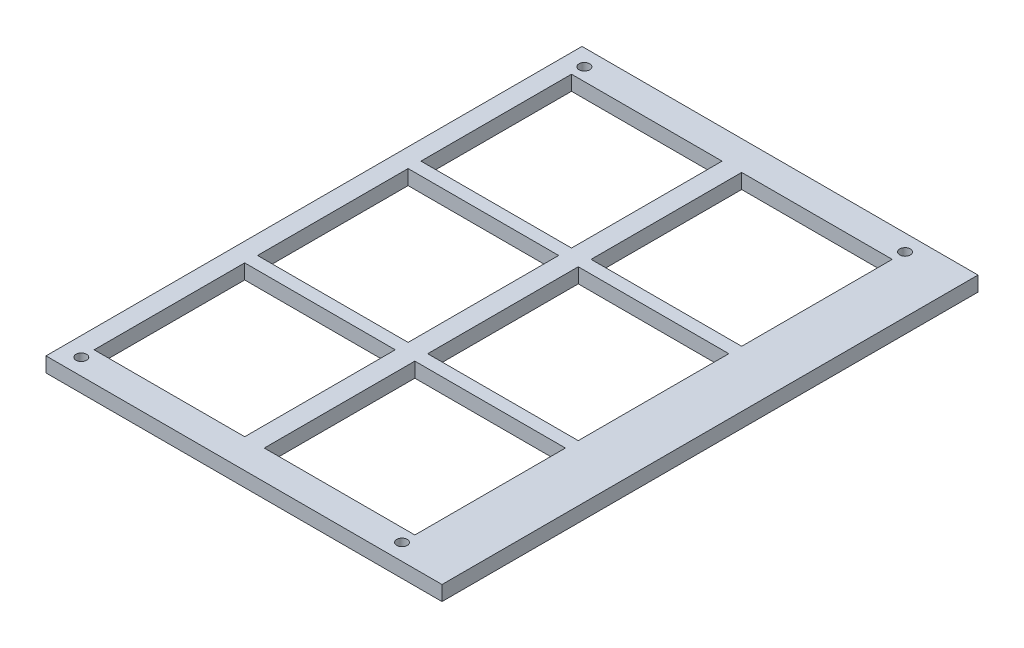
from build123d import *

# Parameters (mm, degrees)
SKETCH1_W                 = 267.22
SKETCH1_H                 = 361.68
SKETCH1_R                 = 3.57
BOSS_EXTRUDE1_DEPTH       = 10
SKETCH2_W                 = 101.6
SKETCH2_H                 = 101.6
CUT_EXTRUDE1_DEPTH        = 226.066074076
LPATTERN1_COUNT           = 2
LPATTERN1_PITCH           = 110.265
LPATTERN2_COUNT           = 2
LPATTERN2_PITCH           = 110.265
LPATTERN3_COUNT           = 2
LPATTERN3_PITCH           = 114.82
LPATTERN3_COPY_1_SKETCH_W = 101.6
LPATTERN3_COPY_1_SKETCH_H = 101.6
LPATTERN3_COPY_1_DEPTH    = 226.066074076
LPATTERN3_COPY_2_SKETCH_W = 101.6
LPATTERN3_COPY_2_SKETCH_H = 101.6
LPATTERN3_COPY_2_DEPTH    = 226.066074076


with BuildPart() as part:
    # Sketch1 → Boss-Extrude1 (new body)
    with BuildSketch(Plane(origin=(0, 0, 0), x_dir=(1, 0, 0), z_dir=(0, 1, 0))):
        Rectangle(SKETCH1_W, SKETCH1_H)
        with Locations(Location((-120.91, -169.7275, 0), (0, 0, 270))):
            Circle(SKETCH1_R, mode=Mode.SUBTRACT)
        with Locations(Location((-120.91, 169.7275, 0), (0, 0, 270))):
            Circle(SKETCH1_R, mode=Mode.SUBTRACT)
        with Locations(Location((95.51, 169.7275, 0), (0, 0, 270))):
            Circle(SKETCH1_R, mode=Mode.SUBTRACT)
        with Locations(Location((95.51, -169.7275, 0), (0, 0, 270))):
            Circle(SKETCH1_R, mode=Mode.SUBTRACT)
    extrude(amount=BOSS_EXTRUDE1_DEPTH)

    # Sketch2 → Cut-Extrude1 (cut, through all)
    with BuildSketch(Plane(origin=(0, 10, 0), x_dir=(1, 0, 0), z_dir=(0, 1, 0))):
        with Locations((-70.11, 0)):
            Rectangle(SKETCH2_W, SKETCH2_H)
    cut_extrude1 = extrude(amount=-CUT_EXTRUDE1_DEPTH, mode=Mode.SUBTRACT)

    # LPattern1: Cut-Extrude1 ×2
    with Locations(*[(0, 0, -i * LPATTERN1_PITCH) for i in range(1, LPATTERN1_COUNT)]):
        add(cut_extrude1, mode=Mode.SUBTRACT)

    # LPattern2: Cut-Extrude1 ×2
    with Locations(*[(0, 0, i * LPATTERN2_PITCH) for i in range(1, LPATTERN2_COUNT)]):
        add(cut_extrude1, mode=Mode.SUBTRACT)

    # LPattern3: Cut-Extrude1 ×2
    with Locations(*[(i * LPATTERN3_PITCH, 0, 0) for i in range(1, LPATTERN3_COUNT)]):
        add(cut_extrude1, mode=Mode.SUBTRACT)

    # LPattern3 copy 1 sketch → LPattern3 copy 1 (cut, through all)
    with BuildSketch(Plane(origin=(114.82, 10, -110.265), x_dir=(1, 0, 0), z_dir=(0, 1, 0))):
        with Locations((-70.11, 0)):
            Rectangle(LPATTERN3_COPY_1_SKETCH_W, LPATTERN3_COPY_1_SKETCH_H)
    extrude(amount=-LPATTERN3_COPY_1_DEPTH, mode=Mode.SUBTRACT)

    # LPattern3 copy 2 sketch → LPattern3 copy 2 (cut, through all)
    with BuildSketch(Plane(origin=(114.82, 10, 110.265), x_dir=(1, 0, 0), z_dir=(0, 1, 0))):
        with Locations((-70.11, 0)):
            Rectangle(LPATTERN3_COPY_2_SKETCH_W, LPATTERN3_COPY_2_SKETCH_H)
    extrude(amount=-LPATTERN3_COPY_2_DEPTH, mode=Mode.SUBTRACT)


solid = part.part
